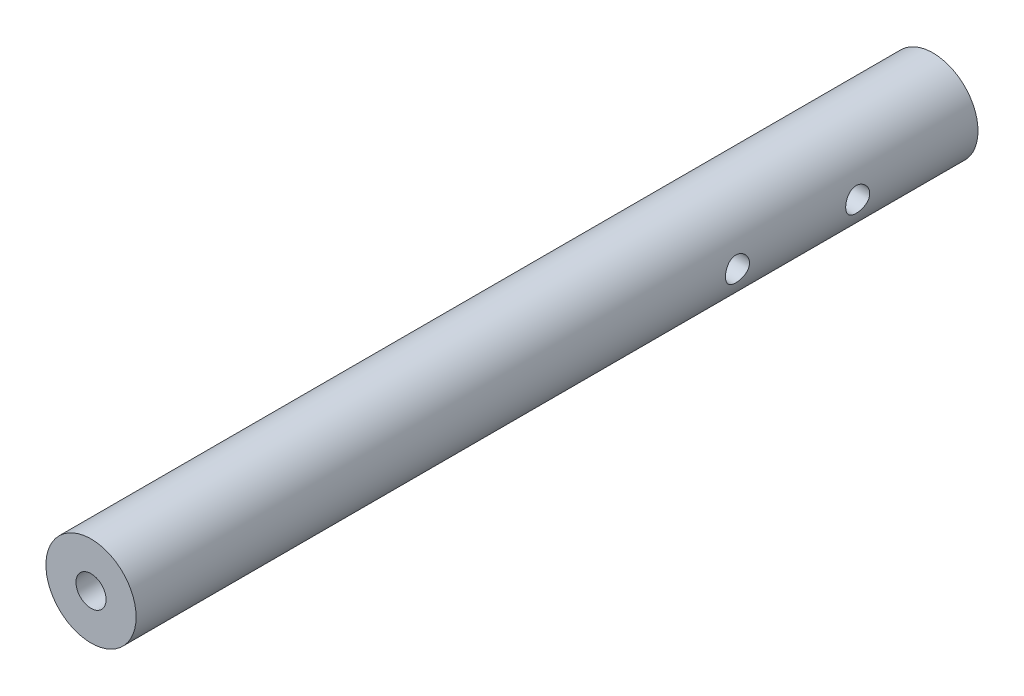
from build123d import *

# Parameters (mm, degrees)
SKETCH1_R           = 7.5
SKETCH1_R_2         = 2.5
BOSS_EXTRUDE1_DEPTH = 140
SKETCH2_R           = 2
CUT_EXTRUDE1_DEPTH  = 16


with BuildPart() as part:
    # Sketch1 → Boss-Extrude1 (new body)
    with BuildSketch(Plane.XY):
        Circle(SKETCH1_R)
        Circle(SKETCH1_R_2, mode=Mode.SUBTRACT)
    extrude(amount=BOSS_EXTRUDE1_DEPTH)

    # Sketch2 → Cut-Extrude1 (cut)
    with BuildSketch(Plane.ZY.offset(7.5)):
        with Locations((20, 0)):
            Circle(SKETCH2_R)
        with Locations((40, 0)):
            Circle(SKETCH2_R)
    extrude(amount=-CUT_EXTRUDE1_DEPTH, mode=Mode.SUBTRACT)


solid = part.part
